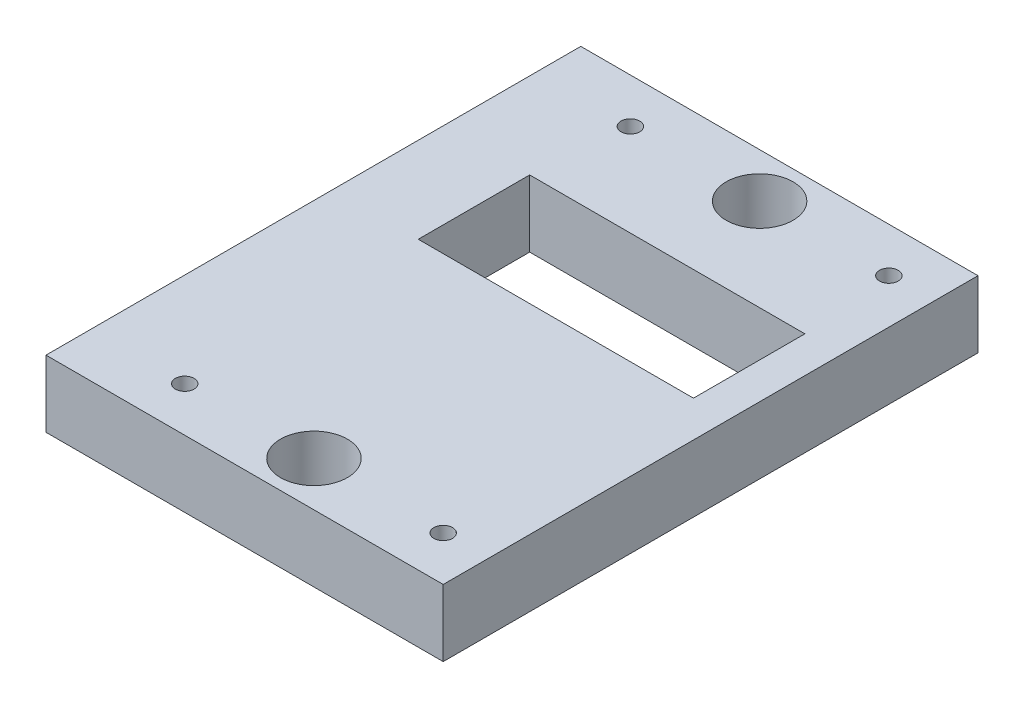
from build123d import *

# Parameters (mm, degrees)
SKETCH1_W           = 89.125
SKETCH1_H           = 120
BOSS_EXTRUDE1_DEPTH = 7.5
CUT_EXTRUDE1_REACH  = 152.227
SKETCH3_W           = 61.75
SKETCH3_H           = 25
CUT_EXTRUDE2_REACH  = 152.227
SKETCH4_R           = 7.5
M5_TAPPED_HOLE1_D   = 4.2
SKETCH10_R          = 6.25
CUT_EXTRUDE3_DEPTH  = 5


with BuildPart() as part:
    # Sketch1 → Boss-Extrude1 (new, symmetric)
    with BuildSketch(Plane(origin=(0, 0, 0), x_dir=(1, 0, 0), z_dir=(0, 1, 0))):
        with Locations((-44.5625, -60)):
            Rectangle(SKETCH1_W, SKETCH1_H)
    extrude(amount=BOSS_EXTRUDE1_DEPTH, both=True)

    # Sketch3 → Cut-Extrude1 (cut, up to next)
    with BuildSketch(Plane(origin=(0, 7.5, 0), x_dir=(1, 0, 0), z_dir=(0, 1, 0)), mode=Mode.PRIVATE) as cut_extrude1_sk1:
        with Locations((-39, -43.22)):
            Rectangle(SKETCH3_W, SKETCH3_H)
    cut_extrude1_tool1 = extrude(cut_extrude1_sk1.sketch, amount=-CUT_EXTRUDE1_REACH, mode=Mode.PRIVATE) & part.part
    add(cut_extrude1_tool1.solids().sort_by_distance((-39, 7.5, 43.22))[0], mode=Mode.SUBTRACT)

    # Sketch4 → Cut-Extrude2 (cut, up to next)
    with BuildSketch(Plane(origin=(0, 7.5, 0), x_dir=(1, 0, 0), z_dir=(0, 1, 0)), mode=Mode.PRIVATE) as cut_extrude2_sk1:
        with Locations(Location((-39, -10, 0), (0, 0, 270))):
            Circle(SKETCH4_R)
    cut_extrude2_tool1 = extrude(cut_extrude2_sk1.sketch, amount=-CUT_EXTRUDE2_REACH, mode=Mode.PRIVATE) & part.part
    # Sketch4 → Cut-Extrude2 (cut, up to next)
    with BuildSketch(Plane(origin=(0, 7.5, 0), x_dir=(1, 0, 0), z_dir=(0, 1, 0)), mode=Mode.PRIVATE) as cut_extrude2_sk2:
        with Locations(Location((-39, -110, 0), (0, 0, 270))):
            Circle(SKETCH4_R)
    cut_extrude2_tool2 = extrude(cut_extrude2_sk2.sketch, amount=-CUT_EXTRUDE2_REACH, mode=Mode.PRIVATE) & part.part
    add(cut_extrude2_tool1.solids().sort_by_distance((-39, 7.5, 10))[0], mode=Mode.SUBTRACT)
    add(cut_extrude2_tool2.solids().sort_by_distance((-39, 7.5, 110))[0], mode=Mode.SUBTRACT)

    # M5 Tapped Hole1 (through all)
    with Locations(Plane(origin=(0, -7.5, 0), x_dir=(-1, 0, 0), z_dir=(0, -1, 0))):
        with Locations((10, -10), (68, -10), (68, -110), (10, -110)):
            Hole(M5_TAPPED_HOLE1_D / 2)

    # Sketch10 → Cut-Extrude3 (cut)
    with BuildSketch(Plane.XZ.offset(7.5)):
        with Locations(Location((-68, 110, 0), (0, 0, 270))):
            Circle(SKETCH10_R)
        with Locations(Location((-10, 110, 0), (0, 0, 270))):
            Circle(SKETCH10_R)
        with Locations(Location((-68, 10, 0), (0, 0, 270))):
            Circle(SKETCH10_R)
        with Locations(Location((-10, 10, 0), (0, 0, 270))):
            Circle(SKETCH10_R)
    extrude(amount=-CUT_EXTRUDE3_DEPTH, mode=Mode.SUBTRACT)


solid = part.part
